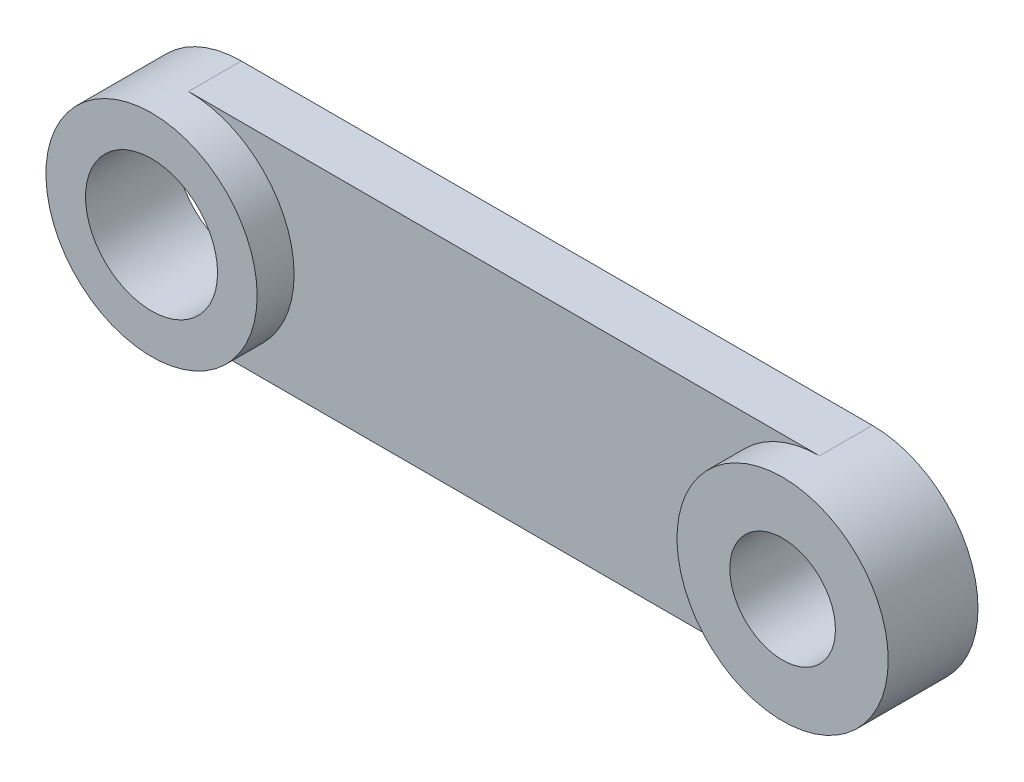
from build123d import *

# Parameters (mm, degrees)
SCHIZZO1_W                   = 119.5
SCHIZZO1_H                   = 40
ESTRUSIONE_ESTRUSIONE1_DEPTH = 10
SCHIZZO2_R                   = 20
ESTRUSIONE_ESTRUSIONE2_DEPTH = 17
SCHIZZO3_R                   = 12.5
SCHIZZO3_R_2                 = 10
TAGLIO_ESTRUSIONE2_DEPTH     = 84.958695202


with BuildPart() as part:
    # Schizzo1 → Estrusione-Estrusione1 (new body)
    with BuildSketch(Plane.XY):
        Rectangle(SCHIZZO1_W, SCHIZZO1_H)
    extrude(amount=ESTRUSIONE_ESTRUSIONE1_DEPTH)

    # Schizzo2 → Estrusione-Estrusione2 (add)
    with BuildSketch(Plane.XY):
        with Locations(Location((59.75, 0, 0), (0, 0, 90))):
            Circle(SCHIZZO2_R)
        with Locations(Location((-59.75, 0, 0), (0, 0, 90))):
            Circle(SCHIZZO2_R)
    extrude(amount=ESTRUSIONE_ESTRUSIONE2_DEPTH)

    # Schizzo3 → Taglio-Estrusione2 (cut, through all)
    with BuildSketch(Plane.XY):
        with Locations((-59.75, 0)):
            Circle(SCHIZZO3_R)
        with Locations((59.75, 0)):
            Circle(SCHIZZO3_R_2)
    extrude(amount=TAGLIO_ESTRUSIONE2_DEPTH, mode=Mode.SUBTRACT)


solid = part.part
